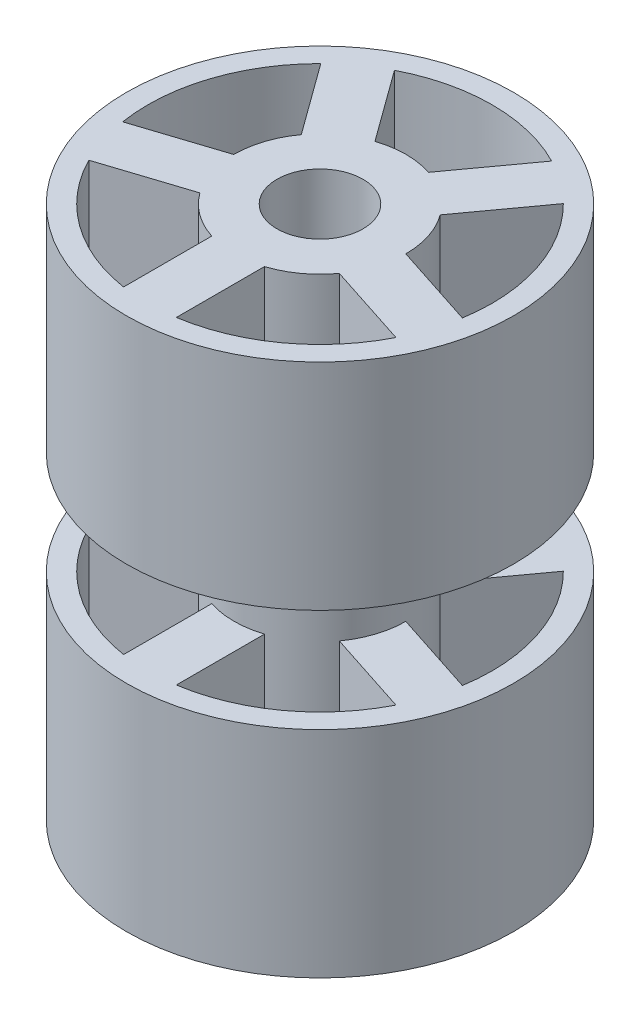
from build123d import *

# Parameters (mm, degrees)
SKETCH1_W           = 2.5
SKETCH1_H           = 25
SKETCH2_W           = 6.130760382
SKETCH2_H           = 11
BOSS_EXTRUDE1_DEPTH = 25
CIRPATTERN1_COUNT   = 5
SKETCH3_W           = 6.130760382
SKETCH3_H           = 12
BOSS_EXTRUDE2_DEPTH = 25
CIRPATTERN2_COUNT   = 5


with BuildPart() as part:
    # Sketch1 → Revolve1 (revolve)
    with BuildSketch(Plane(origin=(0, 0, 0), x_dir=(0, 0, -1), z_dir=(1, 0, 0))):
        with Locations((21.25, 49.5)):
            Rectangle(SKETCH1_W, SKETCH1_H)
        with Locations((21.25, 12.5)):
            Rectangle(SKETCH1_W, SKETCH1_H)
        Polygon((5, 25), (5, 0), (10, 0), (10, 25), (10, 37), (10, 62), (5, 62), (5, 37), align=None)
        Polygon((5, 25), (5, 0), (10, 0), (10, 25), (10, 37), (10, 62), (5, 62), (5, 37), align=None)
    revolve(axis=Axis((0, 0, 0), (0, 1, 0)))

    # Sketch2 → Boss-Extrude1 (add)
    with BuildSketch(Plane.XZ):
        with Locations((0, 15.018584153)):
            Rectangle(SKETCH2_W, SKETCH2_H)
    boss_extrude1 = extrude(amount=-BOSS_EXTRUDE1_DEPTH)

    # CirPattern1: Boss-Extrude1 ×5 about axis
    cirpattern1_axis = Axis((0, 0, 0), (0, 1, 0))
    for i in range(1, CIRPATTERN1_COUNT):
        add(boss_extrude1.rotate(cirpattern1_axis, i * 360 / CIRPATTERN1_COUNT))

    # Sketch3 → Boss-Extrude2 (add)
    with BuildSketch(Plane(origin=(0, 62, 0), x_dir=(-1, 0, 0), z_dir=(0, 1, 0))):
        with Locations((0, 14.863932977)):
            Rectangle(SKETCH3_W, SKETCH3_H)
    boss_extrude2 = extrude(amount=-BOSS_EXTRUDE2_DEPTH)

    # CirPattern2: Boss-Extrude2 ×5 about axis
    cirpattern2_axis = Axis((0, 0, 0), (0, 1, 0))
    for i in range(1, CIRPATTERN2_COUNT):
        add(boss_extrude2.rotate(cirpattern2_axis, i * 360 / CIRPATTERN2_COUNT))


solid = part.part
